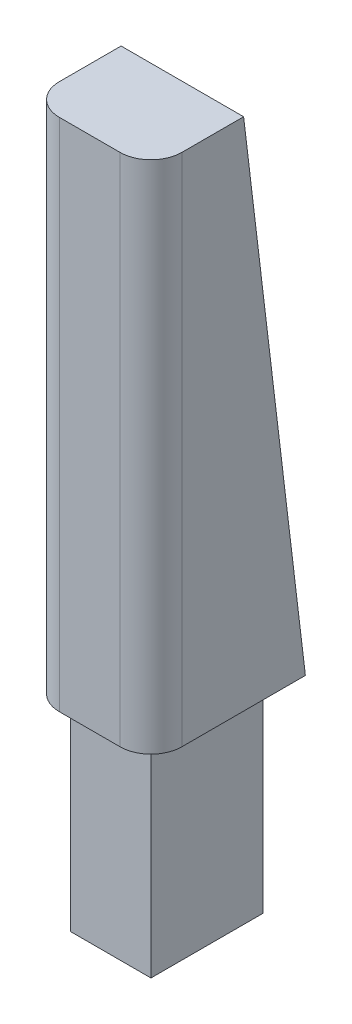
from build123d import *

# Parameters (mm, degrees)
SKETCH1_W               = 7.8
SKETCH1_H               = 10.9
BOSS_EXTRUDE1_DEPTH     = 20
SKETCH2_W               = 11.9
SKETCH2_H               = 15
BOSS_EXTRUDE2_DEPTH     = 50
CUT_EXTRUDE1_DEPTH      = 72.399299716
CUT_EXTRUDE1_DEPTH_BACK = 72.399299716
FILLET1_R               = 3


with BuildPart() as part:
    # Sketch1 → Boss-Extrude1 (new body)
    with BuildSketch(Plane(origin=(0, 0, 0), x_dir=(1, 0, 0), z_dir=(0, 1, 0))):
        Rectangle(SKETCH1_W, SKETCH1_H)
    extrude(amount=BOSS_EXTRUDE1_DEPTH)

    # Sketch2 → Boss-Extrude2 (add)
    with BuildSketch(Plane(origin=(0, 20, 0), x_dir=(1, 0, 0), z_dir=(0, 1, 0))):
        Rectangle(SKETCH2_W, SKETCH2_H)
    extrude(amount=BOSS_EXTRUDE2_DEPTH)

    # Sketch3 → Cut-Extrude1 (cut, two sides: drawn at the far end of the back side and taken through both)
    with BuildSketch(Plane.ZY.offset(5.95).offset(-CUT_EXTRUDE1_DEPTH_BACK)):
        Polygon((-7.5, 20), (-1.5, 70), (-7.5, 70), align=None)
    extrude(amount=CUT_EXTRUDE1_DEPTH + CUT_EXTRUDE1_DEPTH_BACK, mode=Mode.SUBTRACT)

    # Fillet1
    fillet1_edges = [part.edges().sort_by_distance(p)[0] for p in [
        (5.95, 45, 7.5),
        (-5.95, 45, 7.5),
    ]]
    fillet(fillet1_edges, radius=FILLET1_R)


solid = part.part
